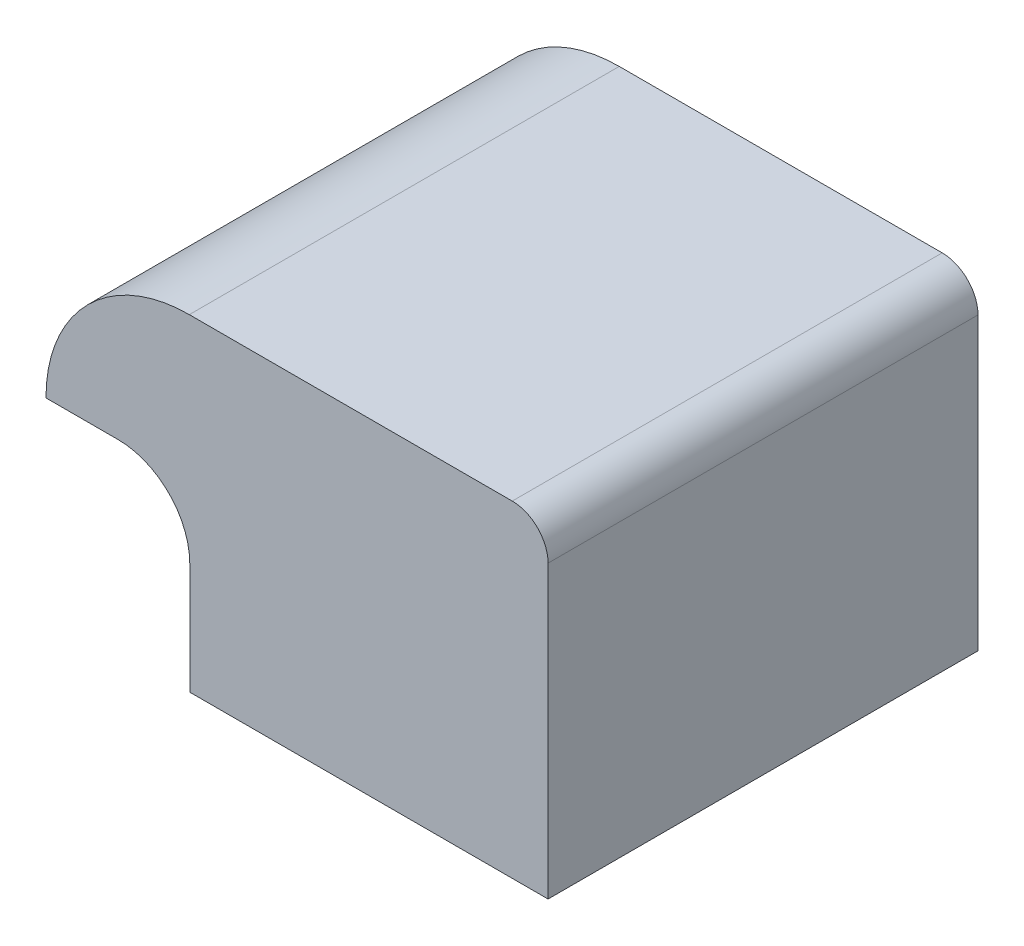
from build123d import *

# Parameters (mm, degrees)
EXTRUDE_1_DEPTH = 6
FILLET_1_R      = 0.5
FILLET_2_R      = 2
FILLET_3_R      = 1


with BuildPart() as part:
    # 草圖1 → 填料-伸長1 (new body)
    with BuildSketch(Plane.XY):
        Polygon((-48.713400366, 0), (-41.70660185, 0), (-41.70660185, -4.56), (-46.70660185, -4.56), (-46.70660185, -2.007214056), (-48.713400366, -2.007214056), align=None)
    extrude(amount=EXTRUDE_1_DEPTH)

    # 圓角1
    fillet_1_edges = [part.edges().sort_by_distance(p)[0] for p in [
        (-41.70660185, 0, 3),
    ]]
    fillet(fillet_1_edges, radius=FILLET_1_R)

    # 圓角2
    fillet_2_edges = [part.edges().sort_by_distance(p)[0] for p in [
        (-48.713400366, 0, 3),
    ]]
    fillet(fillet_2_edges, radius=FILLET_2_R)

    # 圓角3
    fillet_3_edges = [part.edges().sort_by_distance(p)[0] for p in [
        (-46.70660185, -2.007214056, 3),
    ]]
    fillet(fillet_3_edges, radius=FILLET_3_R)


solid = part.part
